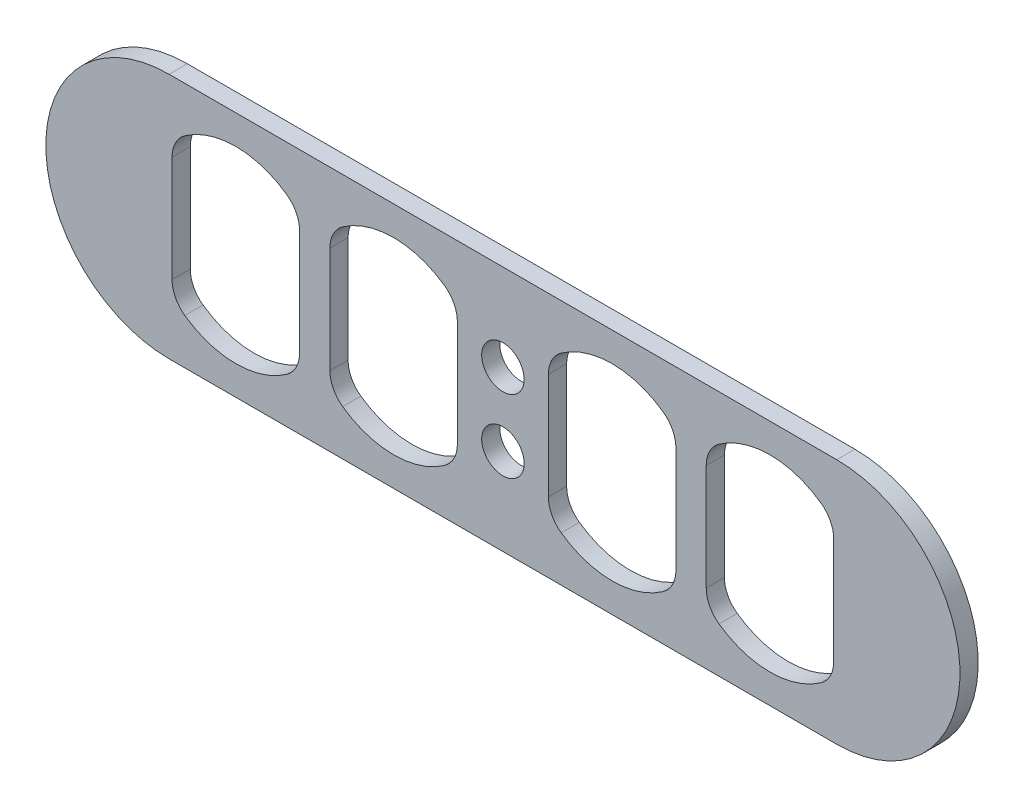
from build123d import *

# Parameters (mm, degrees)
BOSS_EXTRU_1_DEPTH      = 3
ESQUISSE2_R             = 3.5
ENL_V_MAT_EXTRU_1_DEPTH = 79.04601207


with BuildPart() as part:
    # Esquisse1 → Boss.-Extru.1 (new body)
    with BuildSketch(Plane.XY):
        with BuildLine():
            Line((-55, 20.3), (55, 20.3))
            ThreePointArc((55, 20.3), (75.3, 0), (55, -20.3))
            Line((55, -20.3), (-55, -20.3))
            ThreePointArc((-55, -20.3), (-75.3, 0), (-55, 20.3))
        make_face()
    extrude(amount=BOSS_EXTRU_1_DEPTH)

    # Esquisse2 → Enlèv. mat.-Extru.1 (cut, through all)
    with BuildSketch(Plane.XY.offset(3)):
        with Locations((0, 6)):
            Circle(ESQUISSE2_R)
        with Locations((0, -6)):
            Circle(ESQUISSE2_R)
        with BuildLine():
            Line((-7.5, -8.745966692), (-7.5, 8.745966692))
            ThreePointArc((-7.5, 8.745966692), (-8.057383417, 11.040124031), (-9.605263158, 12.822791267))
            ThreePointArc((-9.605263158, 12.822791267), (-18, 15.5), (-26.394736842, 12.822791267))
            ThreePointArc((-26.394736842, 12.822791267), (-27.942616583, 11.040124031), (-28.5, 8.745966692))
            Line((-28.5, 8.745966692), (-28.5, -8.745966692))
            ThreePointArc((-28.5, -8.745966692), (-27.942616583, -11.040124031), (-26.394736842, -12.822791267))
            ThreePointArc((-26.394736842, -12.822791267), (-18, -15.5), (-9.605263158, -12.822791267))
            ThreePointArc((-9.605263158, -12.822791267), (-8.057383417, -11.040124031), (-7.5, -8.745966692))
        make_face()
        with BuildLine():
            Line((-33.5, -8.745966692), (-33.5, 8.745966692))
            ThreePointArc((-33.5, 8.745966692), (-34.057383417, 11.040124031), (-35.605263158, 12.822791267))
            ThreePointArc((-35.605263158, 12.822791267), (-44, 15.5), (-52.394736842, 12.822791267))
            ThreePointArc((-52.394736842, 12.822791267), (-53.942616583, 11.040124031), (-54.5, 8.745966692))
            Line((-54.5, 8.745966692), (-54.5, -8.745966692))
            ThreePointArc((-54.5, -8.745966692), (-53.942616583, -11.040124031), (-52.394736842, -12.822791267))
            ThreePointArc((-52.394736842, -12.822791267), (-44, -15.5), (-35.605263158, -12.822791267))
            ThreePointArc((-35.605263158, -12.822791267), (-34.057383417, -11.040124031), (-33.5, -8.745966692))
        make_face()
        with BuildLine():
            Line((28.5, 8.745966692), (28.5, -8.745966692))
            ThreePointArc((28.5, -8.745966692), (27.942616583, -11.040124031), (26.394736842, -12.822791267))
            ThreePointArc((26.394736842, -12.822791267), (18, -15.5), (9.605263158, -12.822791267))
            ThreePointArc((9.605263158, -12.822791267), (8.057383417, -11.040124031), (7.5, -8.745966692))
            Line((7.5, -8.745966692), (7.5, 8.745966692))
            ThreePointArc((7.5, 8.745966692), (8.057383417, 11.040124031), (9.605263158, 12.822791267))
            ThreePointArc((9.605263158, 12.822791267), (18, 15.5), (26.394736842, 12.822791267))
            ThreePointArc((26.394736842, 12.822791267), (27.942616583, 11.040124031), (28.5, 8.745966692))
        make_face()
        with BuildLine():
            Line((54.5, 8.745966692), (54.5, -8.745966692))
            ThreePointArc((54.5, -8.745966692), (53.942616583, -11.040124031), (52.394736842, -12.822791267))
            ThreePointArc((52.394736842, -12.822791267), (44, -15.5), (35.605263158, -12.822791267))
            ThreePointArc((35.605263158, -12.822791267), (34.057383417, -11.040124031), (33.5, -8.745966692))
            Line((33.5, -8.745966692), (33.5, 8.745966692))
            ThreePointArc((33.5, 8.745966692), (34.057383417, 11.040124031), (35.605263158, 12.822791267))
            ThreePointArc((35.605263158, 12.822791267), (44, 15.5), (52.394736842, 12.822791267))
            ThreePointArc((52.394736842, 12.822791267), (53.942616583, 11.040124031), (54.5, 8.745966692))
        make_face()
    extrude(amount=-ENL_V_MAT_EXTRU_1_DEPTH, mode=Mode.SUBTRACT)


solid = part.part
